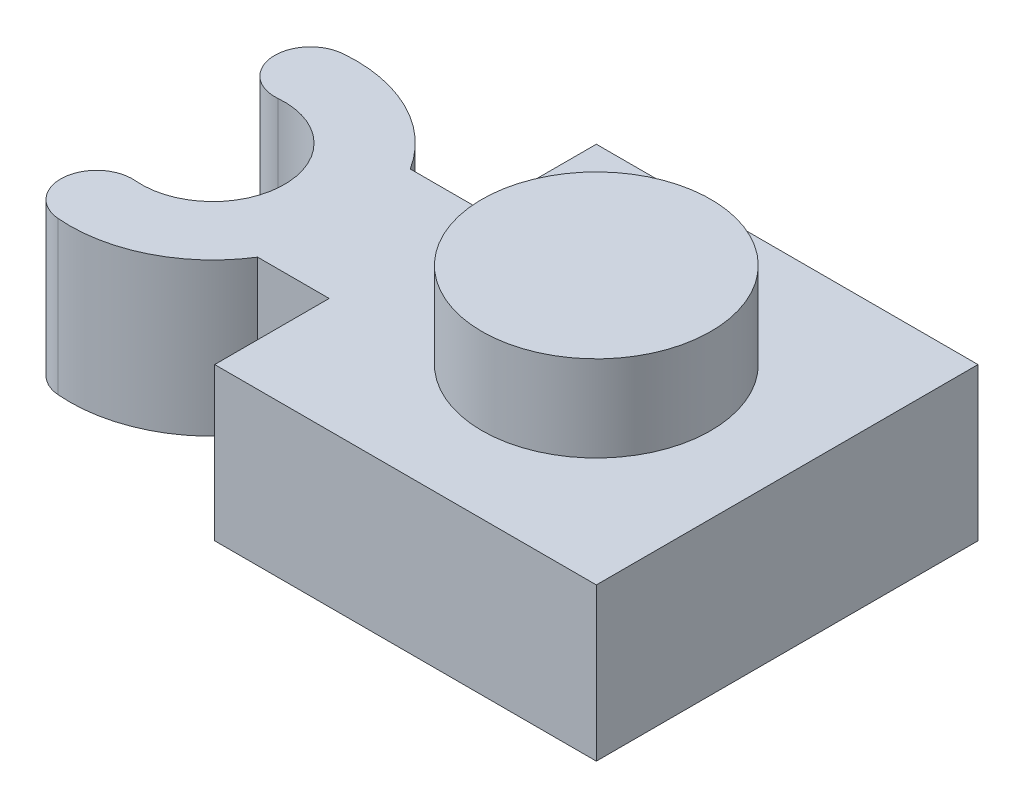
from build123d import *

# Parameters (mm, degrees)
BOSS_EXTRUDE1_DEPTH = 3.2
SKETCH2_R           = 2.4
BOSS_EXTRUDE2_DEPTH = 1.8
SKETCH3_W           = 4.8
SKETCH3_H           = 4.8
CUT_EXTRUDE1_DEPTH  = 1.8


with BuildPart() as part:
    # Sketch1 → Boss-Extrude1 (new body)
    with BuildSketch(Plane(origin=(0, 0, 0), x_dir=(1, 0, 0), z_dir=(0, 1, 0))):
        with BuildLine():
            Line((0, 2.4), (-1.5, 2.4))
            ThreePointArc((-1.5, 2.4), (-2.704535849, 1.312504512), (-4.299182736, 1.011415906))
            ThreePointArc((-4.299182736, 1.011415906), (-4.980961953, 1.823928736), (-4.168449122, 2.505707953))
            ThreePointArc((-4.168449122, 2.505707953), (-2.537715508, 4), (-4.168449122, 5.494292047))
            ThreePointArc((-4.168449122, 5.494292047), (-4.980961953, 6.176071264), (-4.299182736, 6.988584094))
            ThreePointArc((-4.299182736, 6.988584094), (-2.704535849, 6.687495488), (-1.5, 5.6))
            Line((-1.5, 5.6), (0, 5.6))
            Line((0, 5.6), (0, 8))
            Line((0, 8), (8, 8))
            Line((8, 8), (8, 0))
            Line((8, 0), (0, 0))
            Line((0, 0), (0, 2.4))
        make_face()
    extrude(amount=BOSS_EXTRUDE1_DEPTH)

    # Sketch2 → Boss-Extrude2 (add)
    with BuildSketch(Plane(origin=(0, 3.2, 0), x_dir=(1, 0, 0), z_dir=(0, 1, 0))):
        with Locations((4, 4)):
            Circle(SKETCH2_R)
    extrude(amount=BOSS_EXTRUDE2_DEPTH)

    # Sketch3 → Cut-Extrude1 (cut)
    with BuildSketch(Plane.XZ):
        with Locations((4, -4)):
            Rectangle(SKETCH3_W, SKETCH3_H)
    extrude(amount=-CUT_EXTRUDE1_DEPTH, mode=Mode.SUBTRACT)


solid = part.part
